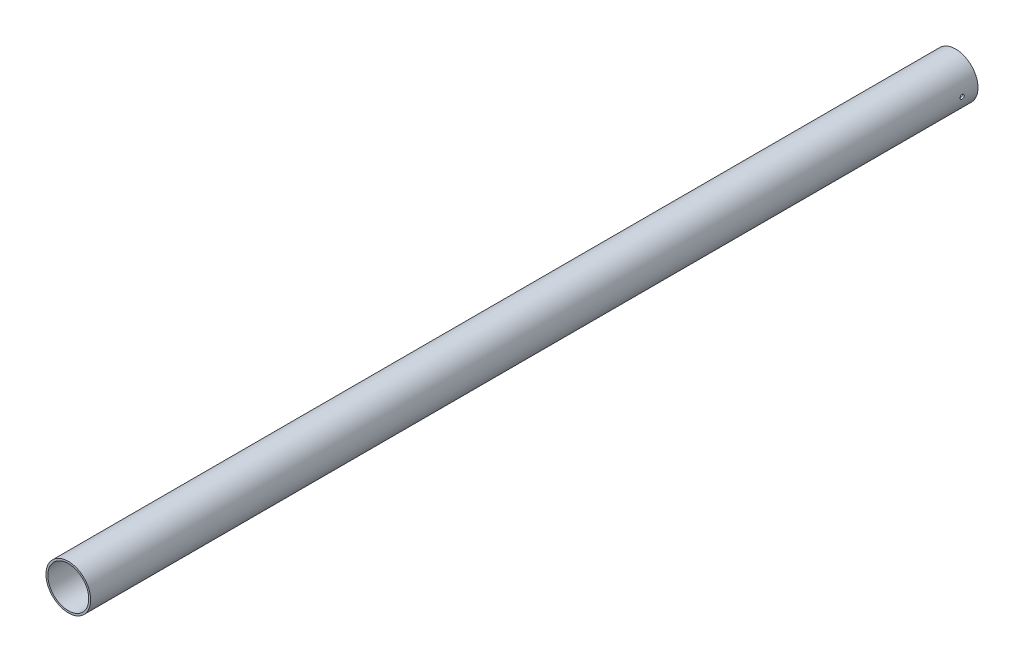
from build123d import *

# Parameters (mm, degrees)
SKETCH1_R           = 12.7
SKETCH1_R_2         = 11.6205
BOSS_EXTRUDE1_DEPTH = 504.28
SKETCH3_W           = 1.2
SKETCH3_H           = 12.7


with BuildPart() as part:
    # Sketch1 → Boss-Extrude1 (new body)
    with BuildSketch(Plane.XY):
        Circle(SKETCH1_R)
        Circle(SKETCH1_R_2, mode=Mode.SUBTRACT)
    extrude(amount=BOSS_EXTRUDE1_DEPTH)

    # Sketch3 → M2 Clearance Hole1 (revolve, cut)
    with BuildSketch(Plane(origin=(0, 0, 9), x_dir=(0, 0, 1), z_dir=(0, 1, 0))):
        with Locations((0.6, 6.35)):
            Rectangle(SKETCH3_W, SKETCH3_H)
    m2_clearance_hole1 = revolve(axis=Axis((-6.35, 0, 9), (1, 0, 0)), mode=Mode.SUBTRACT)

    # Mirror1: M2 Clearance Hole1 across plane
    add(m2_clearance_hole1.mirror(Plane(origin=(0, 0, 0), x_dir=(0, 0, 1), z_dir=(1, 0, 0))), mode=Mode.SUBTRACT)


solid = part.part
